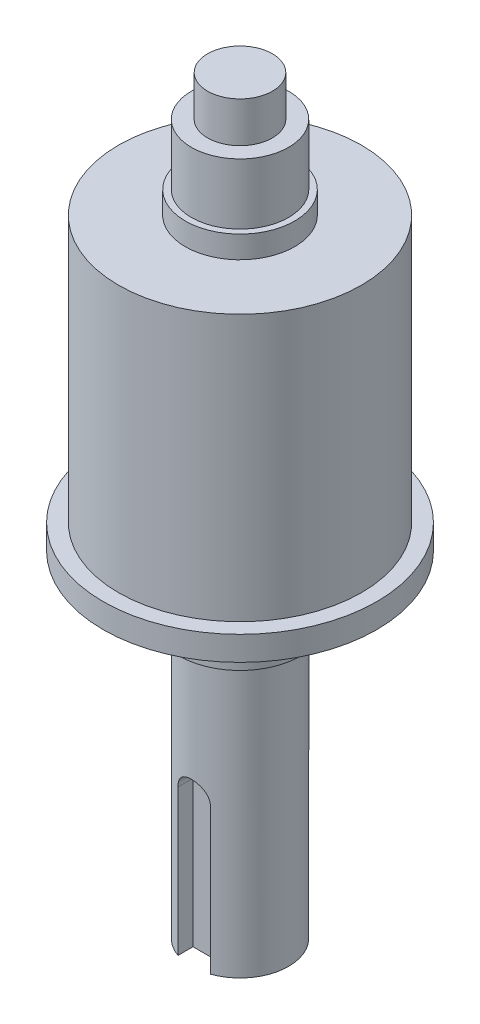
from build123d import *

# Parameters (mm, degrees)
CUT_EXTRUDE1_DEPTH = 15
CUT_EXTRUDE2_DEPTH = 97.309063486


with BuildPart() as part:
    # Sketch2 → Revolve1 (revolve)
    with BuildSketch(Plane.XY, mode=Mode.PRIVATE) as revolve1_sk:
        Polygon((0, 0), (-4, 0), (-4, -5), (-6, -5), (-6, -12.5), (-6.75, -12.5), (-6.75, -15.25), (-14.9815, -15.25), (-14.9815, -48.11), (-16.8815, -48.11), (-16.8815, -51.11), (-8.25, -51.11), (-8.25, -53.61), (-7.5, -53.61), (-7.5, -58.61), (-6, -58.61), (-6, -92.535), (0, -92.535), align=None)
    revolve(revolve1_sk.sketch.rotate(Axis((0, 40.033449689, 0), (0, -1, 0)), 270), axis=Axis((0, 40.033449689, 0), (0, -1, 0)))

    # Sketch3 → Cut-Extrude1 (cut)
    with BuildSketch(Plane.XZ.offset(92.535)):
        with BuildLine():
            Line((-2, 5.656854249), (-2, 3.8))
            Line((-2, 3.8), (2, 3.8))
            Line((2, 3.8), (2, 5.656854249))
            ThreePointArc((2, 5.656854249), (0, 6), (-2, 5.656854249))
        make_face()
    extrude(amount=-CUT_EXTRUDE1_DEPTH, mode=Mode.SUBTRACT)

    # Sketch4 → Cut-Extrude2 (cut, through all)
    with BuildSketch(Plane.XY.offset(3.8)):
        with BuildLine():
            Line((-2, -77.535), (-2, -74.535))
            ThreePointArc((-2, -74.535), (0, -72.535), (2, -74.535))
            Line((2, -74.535), (2, -77.535))
            Line((2, -77.535), (2, -92.535))
            Line((2, -92.535), (-2, -92.535))
            Line((-2, -92.535), (-2, -77.535))
        make_face()
    extrude(amount=CUT_EXTRUDE2_DEPTH, mode=Mode.SUBTRACT)


solid = part.part
